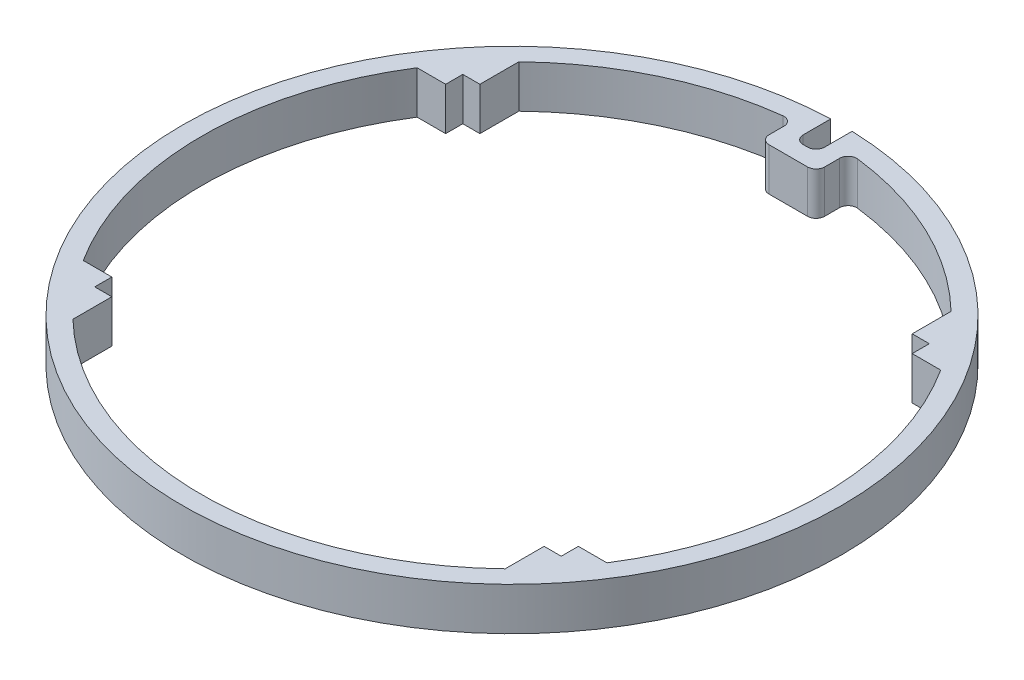
from build123d import *

# Parameters (mm, degrees)
BOSS_EXTRUDE1_DEPTH = 10
BOSS_EXTRUDE2_START = -10
BOSS_EXTRUDE2_DEPTH = 10


with BuildPart() as part:
    # Sketch1 → Boss-Extrude1 (new body)
    with BuildSketch(Plane(origin=(0, 0, 0), x_dir=(1, 0, 0), z_dir=(0, 1, 0))):
        with BuildLine():
            Line((-0.5, 68.548309499), (0.5, 68.548309499))
            ThreePointArc((0.5, 68.548309499), (1.914213562, 69.134095936), (2.5, 70.548309499))
            Line((2.5, 70.548309499), (2.5, 76.509166118))
            ThreePointArc((2.5, 76.509166118), (0, -76.55), (-2.5, 76.509166118))
            Line((-2.5, 76.509166118), (-2.5, 70.548309499))
            ThreePointArc((-2.5, 70.548309499), (-1.914213562, 69.134095936), (-0.5, 68.548309499))
        make_face()
        with BuildLine():
            Line((-4.498898253, 64.545545648), (4.504620523, 64.545545648))
            ThreePointArc((4.504620523, 64.545545648), (5.918834085, 65.131332086), (6.504620523, 66.545545648))
            Line((6.504620523, 66.545545648), (6.504620523, 70.035519058))
            ThreePointArc((6.504620523, 70.035519058), (7.178383305, 71.532547729), (8.745715364, 72.020934198))
            ThreePointArc((8.745715364, 72.020934198), (31.254364336, 65.472644745), (50.5, 52.08889037))
            Line((50.5, 52.08889037), (50.5, 43))
            Line((50.5, 43), (54.5, 43))
            Line((54.5, 43), (54.5, 39))
            Line((54.5, 39), (61.17599611, 39))
            ThreePointArc((61.17599611, 39), (72.55, 0), (61.17599611, -39))
            Line((61.17599611, -39), (54.5, -39))
            Line((54.5, -39), (54.5, -43))
            Line((54.5, -43), (50.5, -43))
            Line((50.5, -43), (50.5, -52.08889037))
            ThreePointArc((50.5, -52.08889037), (0, -72.55), (-50.5, -52.08889037))
            Line((-50.5, -52.08889037), (-50.5, -43))
            Line((-50.5, -43), (-54.5, -43))
            Line((-54.5, -43), (-54.5, -39))
            Line((-54.5, -39), (-61.17599611, -39))
            ThreePointArc((-61.17599611, -39), (-72.50088526, 0), (-61.17599611, 39))
            Line((-61.17599611, 39), (-54.5, 39))
            Line((-54.5, 39), (-54.5, 43))
            Line((-54.5, 43), (-50.5, 43))
            Line((-50.5, 43), (-50.5, 52.08889037))
            ThreePointArc((-50.5, 52.08889037), (-31.251689593, 65.473921507), (-8.739830875, 72.021648525))
            ThreePointArc((-8.739830875, 72.021648525), (-7.172599878, 71.533188183), (-6.498898253, 70.036213693))
            Line((-6.498898253, 70.036213693), (-6.498898253, 66.545545648))
            ThreePointArc((-6.498898253, 66.545545648), (-5.913111815, 65.131332086), (-4.498898253, 64.545545648))
        make_face(mode=Mode.SUBTRACT)
    extrude(amount=BOSS_EXTRUDE1_DEPTH)

    # Sketch2 → Boss-Extrude2 (add)
    with BuildSketch(Plane(origin=(0, 10, 0), x_dir=(1, 0, 0), z_dir=(0, 1, 0)).offset(BOSS_EXTRUDE2_START)):
        with BuildLine():
            ThreePointArc((2.5, 76.509166118), (0, -76.55), (-2.5, 76.509166118))
            Line((-2.5, 76.509166118), (-2.5, 76.959404883))
            ThreePointArc((-2.5, 76.959404883), (0, -77), (2.5, 76.959404883))
            Line((2.5, 76.959404883), (2.5, 76.509166118))
        make_face()
    extrude(amount=BOSS_EXTRUDE2_DEPTH)


solid = part.part
